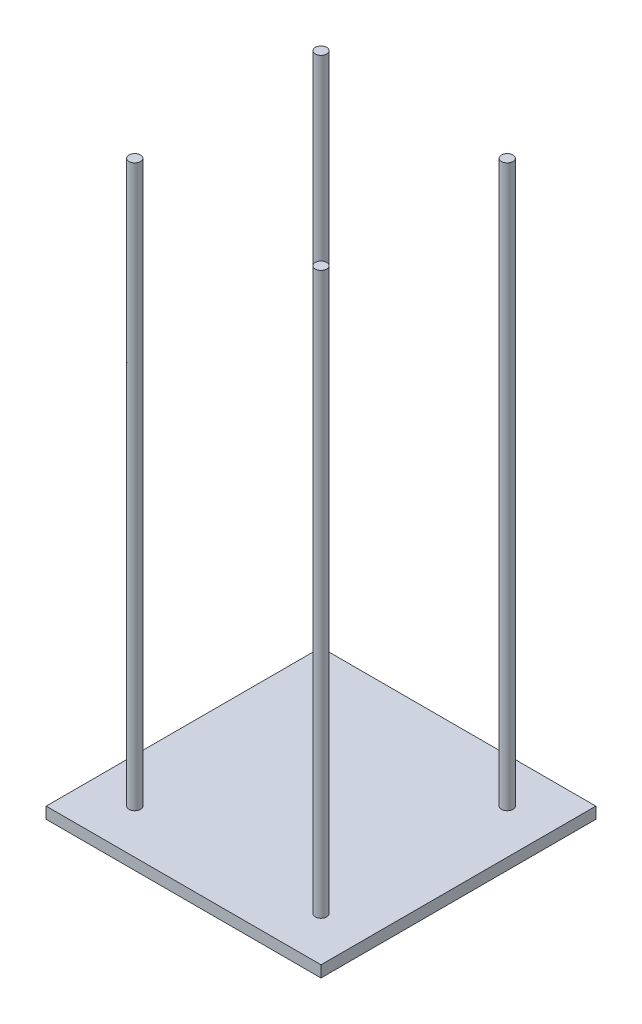
from build123d import *

# Parameters (mm, degrees)
SKETCH1_W           = 120
SKETCH1_H           = 120
SKETCH1_R           = 2.5
BOSS_EXTRUDE1_DEPTH = 5
SKETCH1_3_R         = 2.5
BOSS_EXTRUDE2_DEPTH = 250


with BuildPart() as part:
    # Sketch1 → Boss-Extrude1 (new body)
    with BuildSketch(Plane(origin=(0, 0, 0), x_dir=(1, 0, 0), z_dir=(0, 1, 0))):
        Rectangle(SKETCH1_W, SKETCH1_H)
        with Locations((-40.658639918, -40.658639918)):
            Circle(SKETCH1_R, mode=Mode.SUBTRACT)
        with Locations((40.658639918, -40.658639918)):
            Circle(SKETCH1_R, mode=Mode.SUBTRACT)
        with Locations((-40.658639918, 40.658639918)):
            Circle(SKETCH1_R, mode=Mode.SUBTRACT)
        with Locations((40.658639918, 40.658639918)):
            Circle(SKETCH1_R, mode=Mode.SUBTRACT)
    extrude(amount=BOSS_EXTRUDE1_DEPTH)

    # Sketch1<3> → Boss-Extrude2 (add)
    with BuildSketch(Plane(origin=(0, 0, 0), x_dir=(1, 0, 0), z_dir=(0, 1, 0))):
        with Locations((-40.658639918, 40.658639918)):
            Circle(SKETCH1_3_R)
        with Locations((40.658639918, -40.658639918)):
            Circle(SKETCH1_3_R)
        with Locations((40.658639918, 40.658639918)):
            Circle(SKETCH1_3_R)
        with Locations((-40.658639918, -40.658639918)):
            Circle(SKETCH1_3_R)
    extrude(amount=BOSS_EXTRUDE2_DEPTH)


solid = part.part
